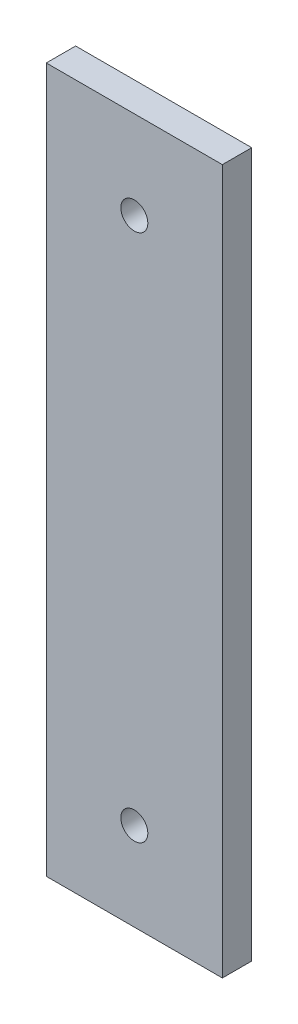
from build123d import *

# Parameters (mm, degrees)
SKETCH2_W           = 19.05
SKETCH2_H           = 76.2
BOSS_EXTRUDE1_DEPTH = 3.175
SKETCH3_R           = 1.4605
CUT_EXTRUDE1_DEPTH  = 79.60930686


with BuildPart() as part:
    # Sketch2 → Boss-Extrude1 (new body)
    with BuildSketch(Plane.XY):
        with Locations((9.525, 38.1)):
            Rectangle(SKETCH2_W, SKETCH2_H)
    extrude(amount=BOSS_EXTRUDE1_DEPTH)

    # Sketch3 → Cut-Extrude1 (cut, through all)
    with BuildSketch(Plane.XY.offset(3.175)):
        with Locations((9.525, 66.675)):
            Circle(SKETCH3_R)
        with Locations((9.525, 9.525)):
            Circle(SKETCH3_R)
    extrude(amount=-CUT_EXTRUDE1_DEPTH, mode=Mode.SUBTRACT)


solid = part.part
